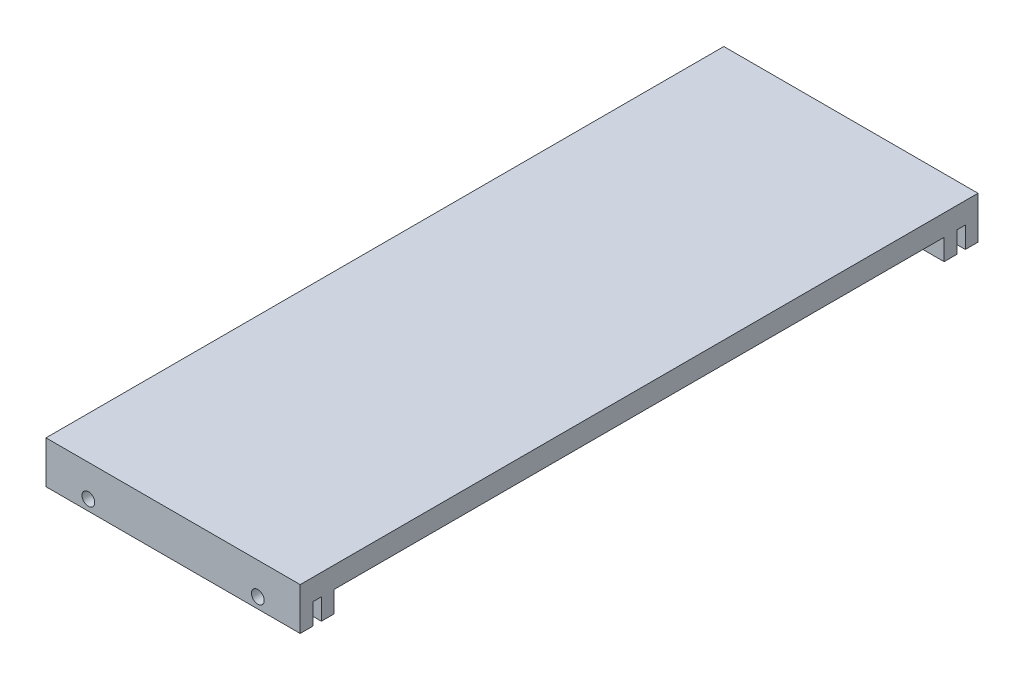
from build123d import *

# Parameters (mm, degrees)
BOSS_EXTRUDE1_DEPTH     = 300
CUT_EXTRUDE1_DEPTH      = 856.862138431
CUT_EXTRUDE1_DEPTH_BACK = 856.862138431
SKETCH2_R               = 7.5


with BuildPart() as part:
    # Sketch1 → Boss-Extrude1 (new body)
    with BuildSketch(Plane(origin=(0, 0, 0), x_dir=(0, 0, -1), z_dir=(1, 0, 0))):
        Polygon((-400, 0), (400, 0), (400, -50), (385, -50), (385, -25), (375, -25), (375, -50), (360, -50), (360, -25), (-360, -25), (-360, -50), (-375, -50), (-375, -25), (-385, -25), (-385, -50), (-400, -50), align=None)
    extrude(amount=BOSS_EXTRUDE1_DEPTH)

    # Sketch2 → Cut-Extrude1 (cut, two sides: drawn at the far end of the back side and taken through both)
    with BuildSketch(Plane.XY.offset(400).offset(-CUT_EXTRUDE1_DEPTH_BACK)):
        with Locations((50, -37.5)):
            Circle(SKETCH2_R)
        with Locations((250, -37.5)):
            Circle(SKETCH2_R)
    extrude(amount=CUT_EXTRUDE1_DEPTH + CUT_EXTRUDE1_DEPTH_BACK, mode=Mode.SUBTRACT)


solid = part.part
